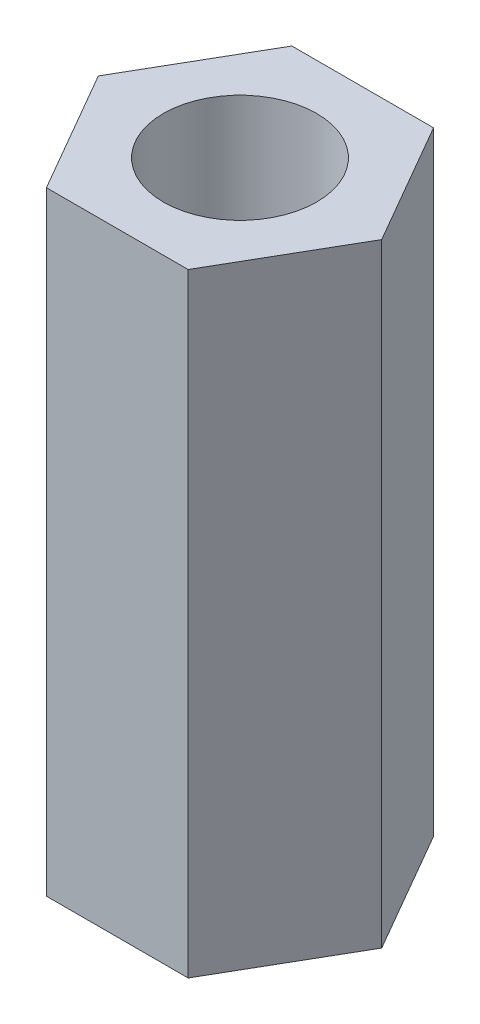
from build123d import *

# Parameters (mm, degrees)
EXTRUDE_1_DEPTH = 10
HOLE_WIZARD_1_D = 2.5


with BuildPart() as part:
    # 草图1 → 凸台-拉伸1 (new body)
    with BuildSketch(Plane(origin=(0, 0, 0), x_dir=(1, 0, 0), z_dir=(0, 1, 0))):
        Polygon((2.309401077, 0), (1.154700538, 2), (-1.154700538, 2), (-2.309401077, 0), (-1.154700538, -2), (1.154700538, -2), align=None)
    extrude(amount=EXTRUDE_1_DEPTH)

    # 孔1 (through all)
    with Locations(Plane(origin=(0, 10, 0), x_dir=(1, 0, 0), z_dir=(0, 1, 0))):
        with Locations((0, 0)):
            Hole(HOLE_WIZARD_1_D / 2)


solid = part.part
